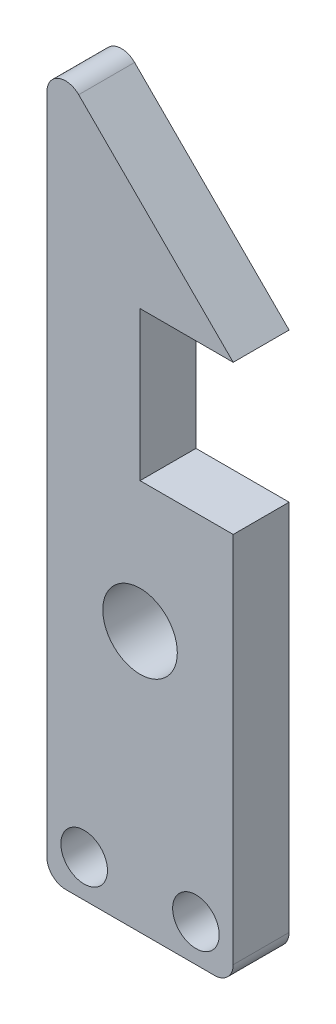
from build123d import *

# Parameters (mm, degrees)
SKETCH_1_R      = 2
SKETCH_1_R_2    = 1.25
EXTRUDE_1_DEPTH = 3
FILLET_1_R      = 1


with BuildPart() as part:
    # 草图1 → 凸台-拉伸1 (new body)
    with BuildSketch(Plane.XY):
        Polygon((10, 0), (10, 21), (5, 21), (5, 29), (10, 29), (0, 39), (0, 0), align=None)
        with Locations((5, 14)):
            Circle(SKETCH_1_R, mode=Mode.SUBTRACT)
        with Locations((2, 2)):
            Circle(SKETCH_1_R_2, mode=Mode.SUBTRACT)
        with Locations((8, 2)):
            Circle(SKETCH_1_R_2, mode=Mode.SUBTRACT)
    extrude(amount=EXTRUDE_1_DEPTH)

    # 圆角1
    fillet_1_edges = [part.edges().sort_by_distance(p)[0] for p in [
        (0, 39, 1.5),
        (10, 0, 1.5),
        (0, 0, 1.5),
    ]]
    fillet(fillet_1_edges, radius=FILLET_1_R)


solid = part.part
